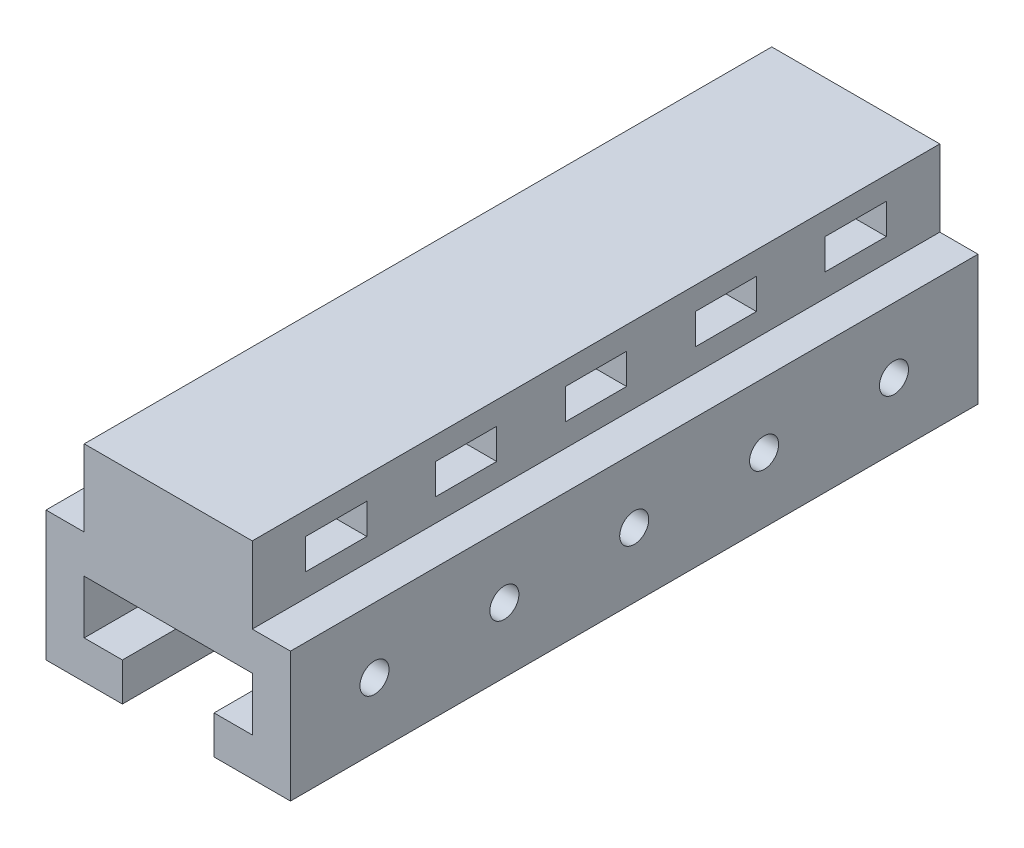
from build123d import *

# Parameters (mm, degrees)
BOSS_EXTRUDE1_DEPTH = 90
SKETCH2_R           = 1.9
CUT_EXTRUDE1_DEPTH  = 99.020406039
SKETCH3_W           = 8
SKETCH3_H           = 4
CUT_EXTRUDE2_DEPTH  = 97.503885932


with BuildPart() as part:
    # Sketch1 → Boss-Extrude1 (new body)
    with BuildSketch(Plane.XY):
        Polygon((11, 5), (-11, 5), (-11, -5), (-16, -5), (-16, -22), (-6, -22), (-6, -17), (-11, -17), (-11, -10), (11, -10), (11, -17), (6, -17), (6, -22), (16, -22), (16, -5), (11, -5), align=None)
    extrude(amount=-BOSS_EXTRUDE1_DEPTH)

    # Sketch2 → Cut-Extrude1 (cut, through all)
    with BuildSketch(Plane(origin=(16, 0, 0), x_dir=(0, 0, -1), z_dir=(1, 0, 0))):
        with Locations((45, -13.5)):
            Circle(SKETCH2_R)
        with Locations((62, -13.5)):
            Circle(SKETCH2_R)
        with Locations((79, -13.5)):
            Circle(SKETCH2_R)
        with Locations((28, -13.5)):
            Circle(SKETCH2_R)
        with Locations((11, -13.5)):
            Circle(SKETCH2_R)
    extrude(amount=-CUT_EXTRUDE1_DEPTH, mode=Mode.SUBTRACT)

    # Sketch3 → Cut-Extrude2 (cut, through all)
    with BuildSketch(Plane(origin=(11, 0, 0), x_dir=(0, 0, -1), z_dir=(1, 0, 0))):
        with Locations((62, 0)):
            Rectangle(SKETCH3_W, SKETCH3_H)
        with Locations((45, 0)):
            Rectangle(SKETCH3_W, SKETCH3_H)
        with Locations((79, 0)):
            Rectangle(SKETCH3_W, SKETCH3_H)
        with Locations((28, 0)):
            Rectangle(SKETCH3_W, SKETCH3_H)
        with Locations((11, 0)):
            Rectangle(SKETCH3_W, SKETCH3_H)
    extrude(amount=-CUT_EXTRUDE2_DEPTH, mode=Mode.SUBTRACT)


solid = part.part
